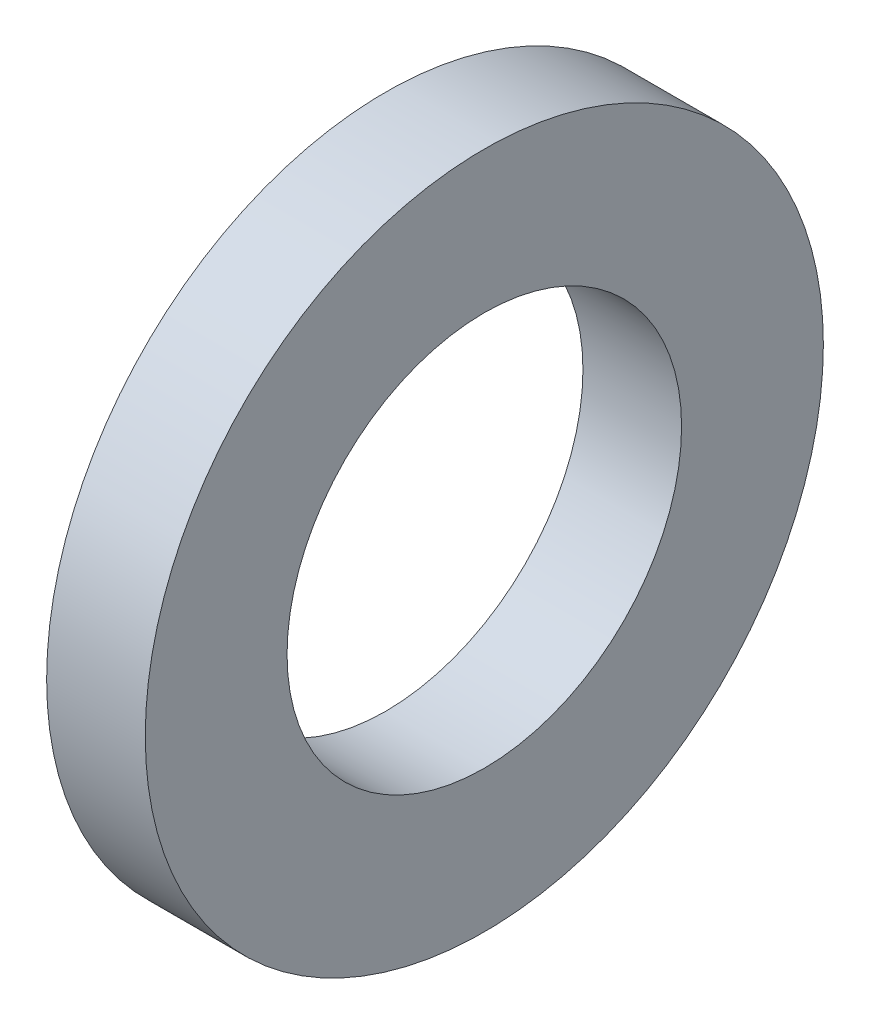
from build123d import *

# Parameters (mm, degrees)
SKETCH1_R      = 5.5
SKETCH1_R_2    = 3.2
EXTRUDE1_DEPTH = 1.6


with BuildPart() as part:
    # Sketch1 → Extrude1 (new body)
    with BuildSketch(Plane(origin=(0, 0, 0), x_dir=(0, 0, -1), z_dir=(1, 0, 0))):
        Circle(SKETCH1_R)
        Circle(SKETCH1_R_2, mode=Mode.SUBTRACT)
    extrude(amount=EXTRUDE1_DEPTH)


solid = part.part
